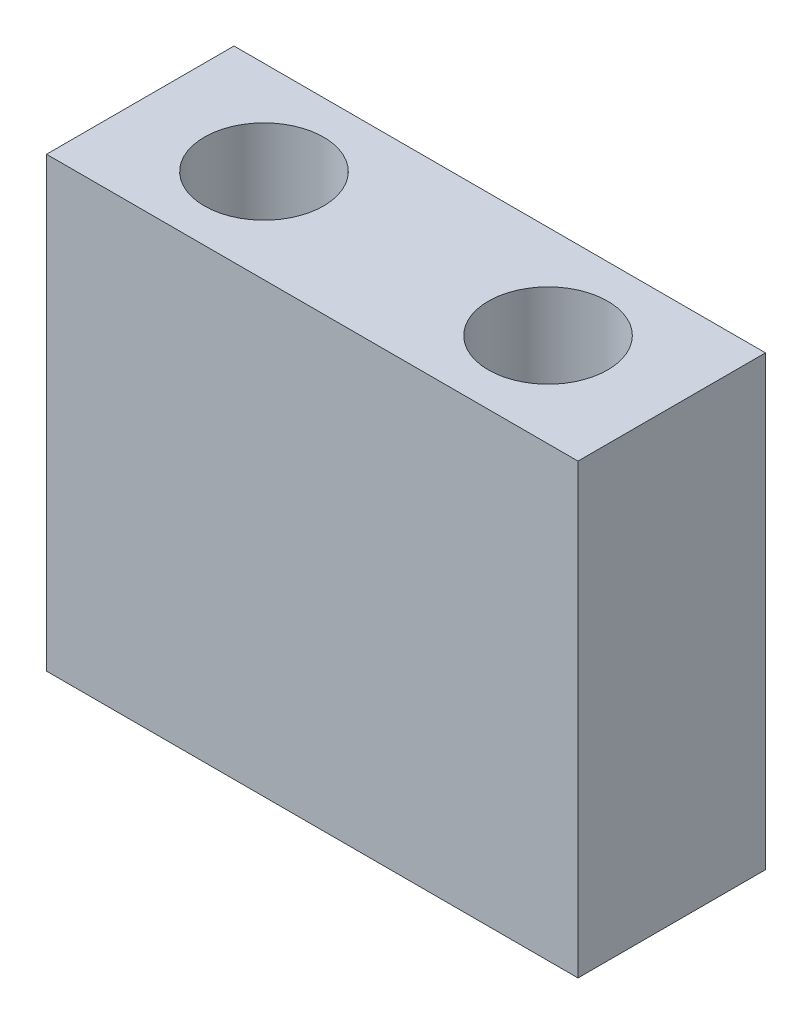
from build123d import *

# Parameters (mm, degrees)
SKETCH1_W             = 18.71
SKETCH1_H             = 6.6
BOSS_EXTRUDE1_DEPTH   = 15.76
M5X0_8_TAPPED_HOLE1_D = 4.2


with BuildPart() as part:
    # Sketch1 → Boss-Extrude1 (new body)
    with BuildSketch(Plane(origin=(0, 0, 0), x_dir=(1, 0, 0), z_dir=(0, 1, 0))):
        Rectangle(SKETCH1_W, SKETCH1_H)
    extrude(amount=BOSS_EXTRUDE1_DEPTH)

    # M5x0.8 Tapped Hole1 (through all)
    with Locations(Plane(origin=(0, 15.76, 0), x_dir=(1, 0, 0), z_dir=(0, 1, 0))):
        with Locations((5, 0), (-5, 0)):
            Hole(M5X0_8_TAPPED_HOLE1_D / 2)


solid = part.part
